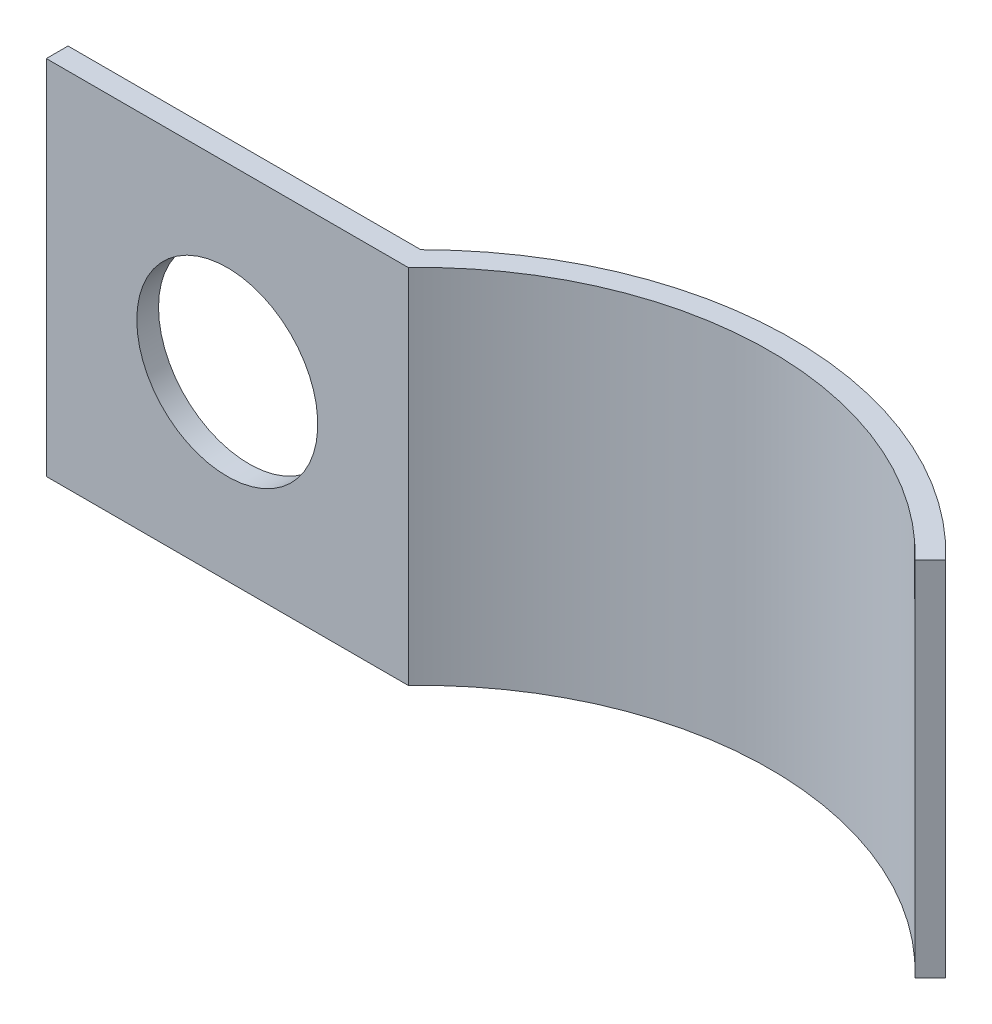
from build123d import *

# Parameters (mm, degrees)
EXTRUDE_1_DEPTH     = 5
SKETCH_2_R          = 1.25
CUT_EXTRUDE_1_DEPTH = 5


with BuildPart() as part:
    # 草图1 → 凸台-拉伸1 (new body)
    with BuildSketch(Plane(origin=(0, 0, 0), x_dir=(1, 0, 0), z_dir=(0, 1, 0))):
        with BuildLine():
            Line((0, 0), (5, 0))
            ThreePointArc((5, 0), (8.5, 1.5), (12, 0))
            Line((12, 0), (12.212191433, 0.212191433))
            ThreePointArc((12.212191433, 0.212191433), (8.561418456, 1.799632562), (4.873707127, 0.3))
            Line((4.873707127, 0.3), (0, 0.3))
            Line((0, 0.3), (0, 0))
        make_face()
    extrude(amount=EXTRUDE_1_DEPTH)

    # 草图2 → 切除-拉伸1 (cut)
    with BuildSketch(Plane(origin=(0, 0, -0.3), x_dir=(-1, 0, 0), z_dir=(0, 0, -1))):
        with Locations((-2.5, 2.5)):
            Circle(SKETCH_2_R)
    extrude(amount=-CUT_EXTRUDE_1_DEPTH, mode=Mode.SUBTRACT)


solid = part.part
